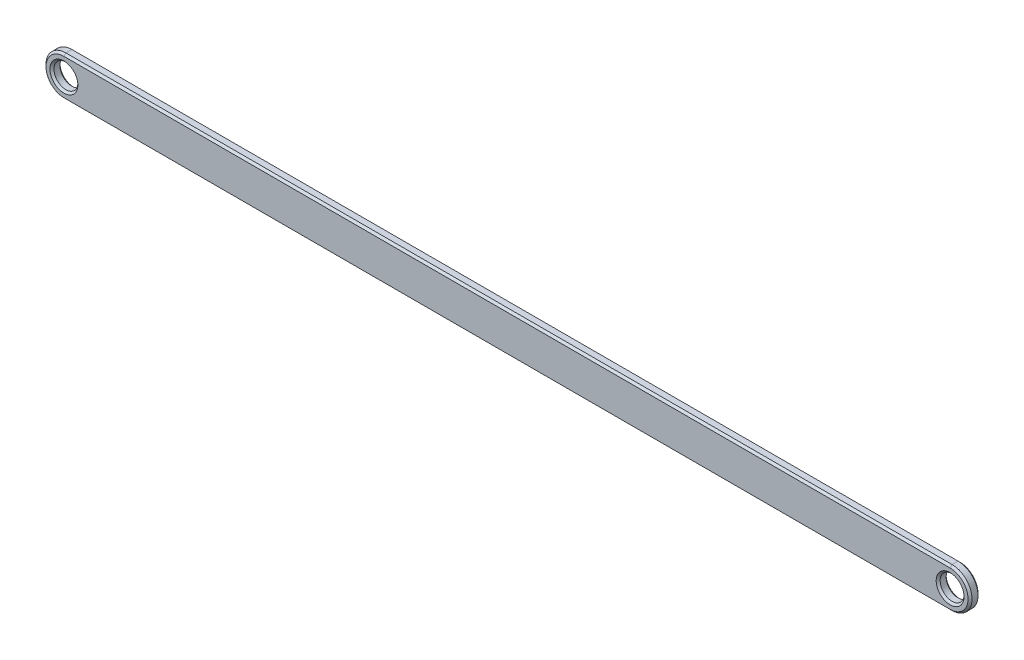
from build123d import *

# Parameters (mm, degrees)
SKETCH1_R           = 30
BOSS_EXTRUDE1_DEPTH = 25
CHAMFER1_SIZE       = 5


with BuildPart() as part:
    # Sketch1 → Boss-Extrude1 (new body)
    with BuildSketch(Plane.XY):
        with BuildLine():
            Line((1112.5, -50), (-1112.5, -50))
            ThreePointArc((-1112.5, -50), (-1162.5, 0), (-1112.5, 50))
            Line((-1112.5, 50), (1112.5, 50))
            ThreePointArc((1112.5, 50), (1162.5, 0), (1112.5, -50))
        make_face()
        with Locations((-1112.5, 0)):
            Circle(SKETCH1_R, mode=Mode.SUBTRACT)
        with Locations(Location((1112.5, 0, 0), (0, 0, 180))):
            Circle(SKETCH1_R, mode=Mode.SUBTRACT)
    extrude(amount=BOSS_EXTRUDE1_DEPTH)

    # Chamfer1
    chamfer1_edges = [part.edges().sort_by_distance(p)[0] for p in [
        (1162.5, 0, 25),
        (-1142.5, 0, 0),
        (-1142.5, 0, 25),
        (0, 50, 25),
        (1142.5, 0, 0),
        (1142.5, 0, 25),
        (-1162.5, 0, 25),
        (0, 50, 0),
        (1162.5, 0, 0),
        (0, -50, 0),
        (-1162.5, 0, 0),
        (0, -50, 25),
    ]]
    chamfer(chamfer1_edges, length=CHAMFER1_SIZE)


solid = part.part
